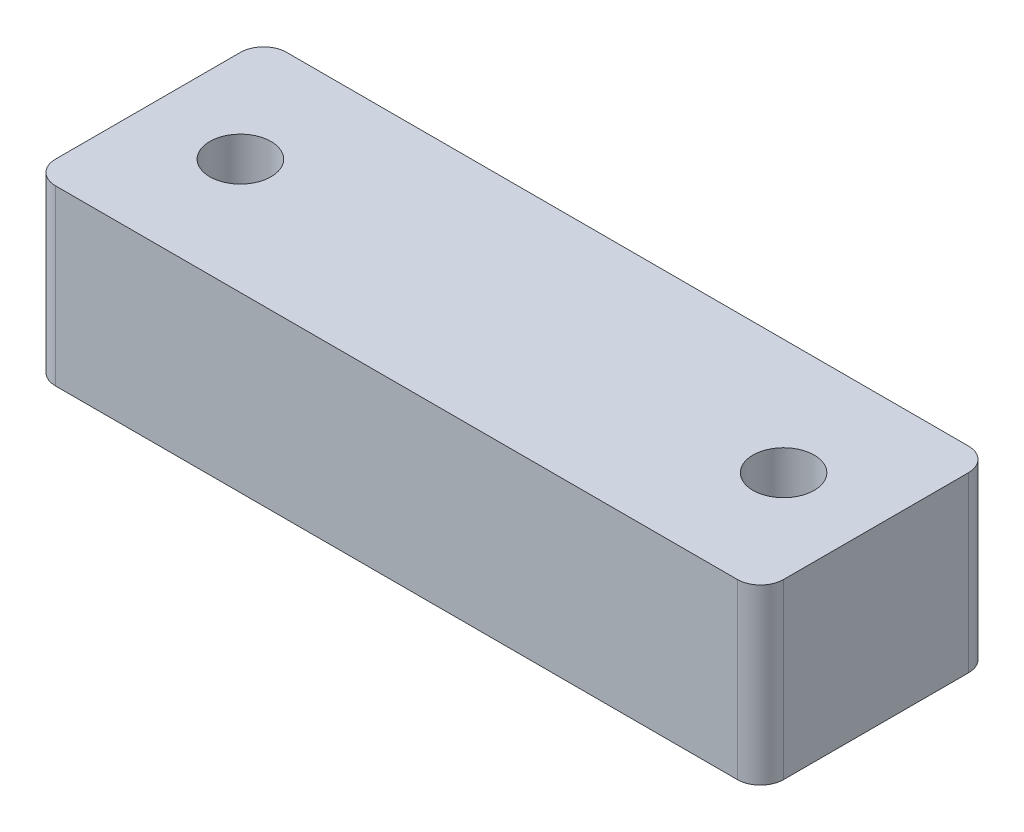
from build123d import *

# Parameters (mm, degrees)
BOSS_EXTRUDE1_DEPTH  = 15
M5_CLEARANCE_HOLE1_D = 5.3


with BuildPart() as part:
    # Sketch1 → Boss-Extrude1 (new body)
    with BuildSketch(Plane(origin=(0, 0, 0), x_dir=(1, 0, 0), z_dir=(0, 1, 0))):
        with BuildLine():
            Line((-11.592711973, 11.480501142), (47.407288027, 11.480501142))
            ThreePointArc((47.407288027, 11.480501142), (48.82150159, 12.06628758), (49.407288027, 13.480501142))
            Line((49.407288027, 13.480501142), (49.407288027, 29.480501142))
            ThreePointArc((49.407288027, 29.480501142), (48.82150159, 30.894714705), (47.407288027, 31.480501142))
            Line((47.407288027, 31.480501142), (-11.592711973, 31.480501142))
            ThreePointArc((-11.592711973, 31.480501142), (-13.006925535, 30.894714705), (-13.592711973, 29.480501142))
            Line((-13.592711973, 29.480501142), (-13.592711973, 13.480501142))
            ThreePointArc((-13.592711973, 13.480501142), (-13.006925535, 12.06628758), (-11.592711973, 11.480501142))
        make_face()
    extrude(amount=BOSS_EXTRUDE1_DEPTH)

    # M5 Clearance Hole1 (through all)
    with Locations(Plane(origin=(0, 15, 0), x_dir=(1, 0, 0), z_dir=(0, 1, 0))):
        with Locations((-5.592711973, 21.480501142), (41.407288027, 21.480501142)):
            Hole(M5_CLEARANCE_HOLE1_D / 2)


solid = part.part
